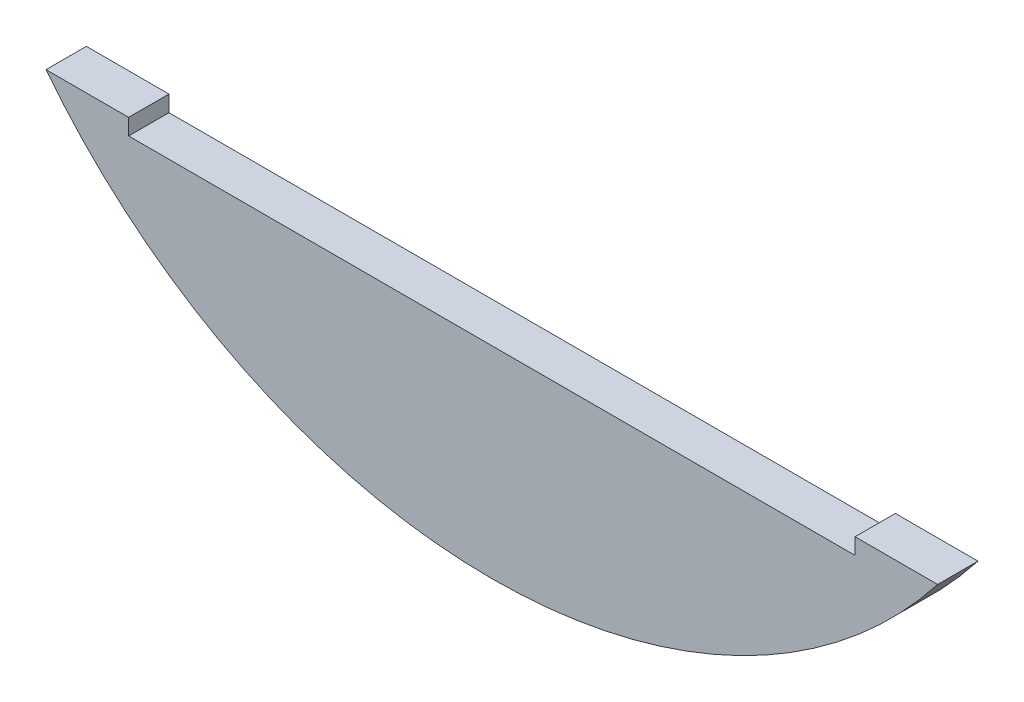
from build123d import *

# Parameters (mm, degrees)
ESQUISSE1_R             = 175
ESQUISSE1_W             = 90
ESQUISSE1_H             = 90
BOSS_EXTRU_1_DEPTH      = 5
ENL_V_START             = -10
ENL_V_MAT_EXTRU_1_DEPTH = 10
ENL_V_MAT_EXTRU_4_DEPTH = 10


with BuildPart() as part:
    # Esquisse1 → Boss.-Extru.1 (new body)
    with BuildSketch(Plane.XY):
        Circle(ESQUISSE1_R)
        Rectangle(ESQUISSE1_W, ESQUISSE1_H, mode=Mode.SUBTRACT)
    extrude(amount=BOSS_EXTRU_1_DEPTH)

    # Esquisse2 → Enlèv. mat.-Extru.1 (cut)
    with BuildSketch(Plane.XY.offset(5).offset(ENL_V_START)):
        with BuildLine():
            Line((-156.468184794, 78.375424383), (-90, 40))
            Line((-90, 40), (-90, -40))
            Line((-90, -40), (-156.468184794, -78.375424383))
            ThreePointArc((-156.468184794, -78.375424383), (-175, 0), (-156.468184794, 78.375424383))
        make_face()
    extrude(amount=ENL_V_MAT_EXTRU_1_DEPTH, mode=Mode.SUBTRACT)

    # Esquisse3 → Enlèv. mat.-Extru.4 (cut)
    with BuildSketch(Plane.XY.offset(5).offset(ENL_V_START)):
        with BuildLine():
            Line((-200, 207), (200, 207))
            Line((200, 207), (200, -43))
            Line((200, -43), (169.634902069, -43))
            ThreePointArc((169.634902069, -43), (18.873149539, -173.979321261), (-156.468184794, -78.375424383))
            Line((-156.468184794, -78.375424383), (-95.196152423, -43))
            Line((-95.196152423, -43), (-200, -43))
            Line((-200, -43), (-200, 207))
        make_face()
        with BuildLine():
            Line((-55.235857919, -43), (55.235857919, -43))
            ThreePointArc((55.235857919, -43), (0, -70), (-55.235857919, -43))
        make_face(mode=Mode.SUBTRACT)
    extrude(amount=ENL_V_MAT_EXTRU_4_DEPTH, mode=Mode.SUBTRACT)


solid = part.part
